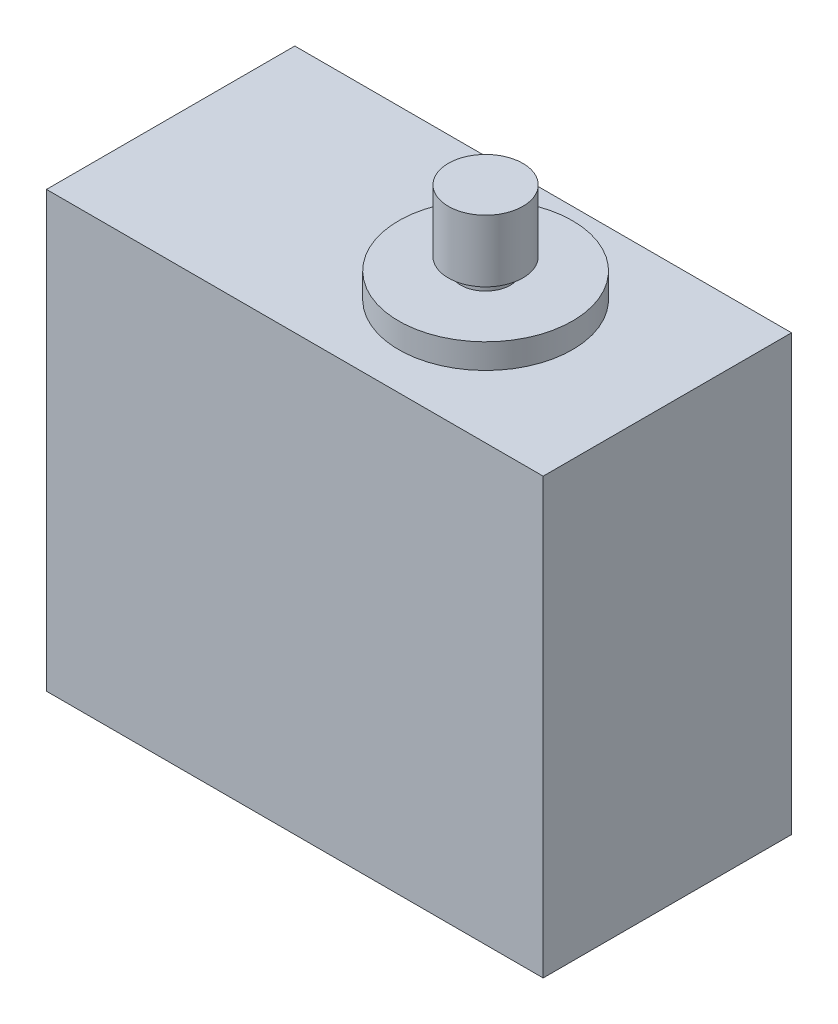
from build123d import *

# Parameters (mm, degrees)
SKETCH_1_W      = 40
SKETCH_1_H      = 35
EXTRUDE_1_DEPTH = 10


with BuildPart() as part:
    # ｽｹｯﾁ1 → ﾎﾞｽ - 押し出し1 (new, symmetric)
    with BuildSketch(Plane.XY):
        with Locations((20, 17.5)):
            Rectangle(SKETCH_1_W, SKETCH_1_H)
    extrude(amount=EXTRUDE_1_DEPTH, both=True)

    # ｽｹｯﾁ2 → 回転1 (revolve)
    with BuildSketch(Plane.XY, mode=Mode.PRIVATE) as revolve_1_sk:
        Polygon((25.364248034, 35), (25.364248034, 43), (22.364248034, 43), (22.364248034, 38), (23.364248034, 38), (23.364248034, 37), (18.364248034, 37), (18.364248034, 35), align=None)
    revolve(revolve_1_sk.sketch.rotate(Axis((25.364248034, 35, 0), (0, 1, 0)), 270), axis=Axis((25.364248034, 35, 0), (0, 1, 0)))


solid = part.part
